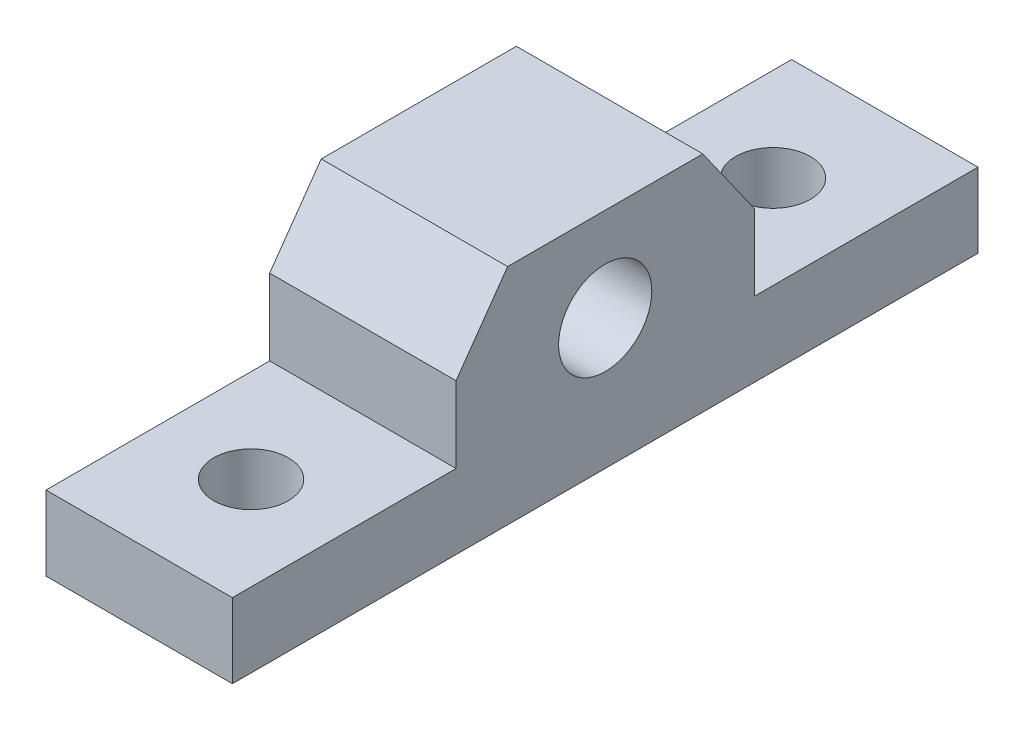
from build123d import *

# Parameters (mm, degrees)
SKETCH_2_R          = 2.5
EXTRUDE_1_DEPTH     = 10
SKETCH_3_R          = 2
CUT_EXTRUDE_2_DEPTH = 43


with BuildPart() as part:
    # Эскиз2 → Вытянуть1 (new body)
    with BuildSketch(Plane(origin=(0, 0, 0), x_dir=(0, 0, -1), z_dir=(1, 0, 0))):
        Polygon((0, 5), (40, 5), (40, 9), (28, 9), (28, 13.077507284), (25.234860189, 17), (14.765139811, 17), (12, 13.077507284), (12, 9), (0, 9), align=None)
        with Locations((20, 12)):
            Circle(SKETCH_2_R, mode=Mode.SUBTRACT)
    extrude(amount=EXTRUDE_1_DEPTH)

    # Эскиз3 → Вытянуть2 (cut, through all)
    with BuildSketch(Plane(origin=(0, 9, 0), x_dir=(1, 0, 0), z_dir=(0, 1, 0))):
        with Locations(Location((5, 6, 0), (0, 0, 270))):
            Circle(SKETCH_3_R)
        with Locations(Location((5, 34, 0), (0, 0, 90))):
            Circle(SKETCH_3_R)
    extrude(amount=-CUT_EXTRUDE_2_DEPTH, mode=Mode.SUBTRACT)


solid = part.part
